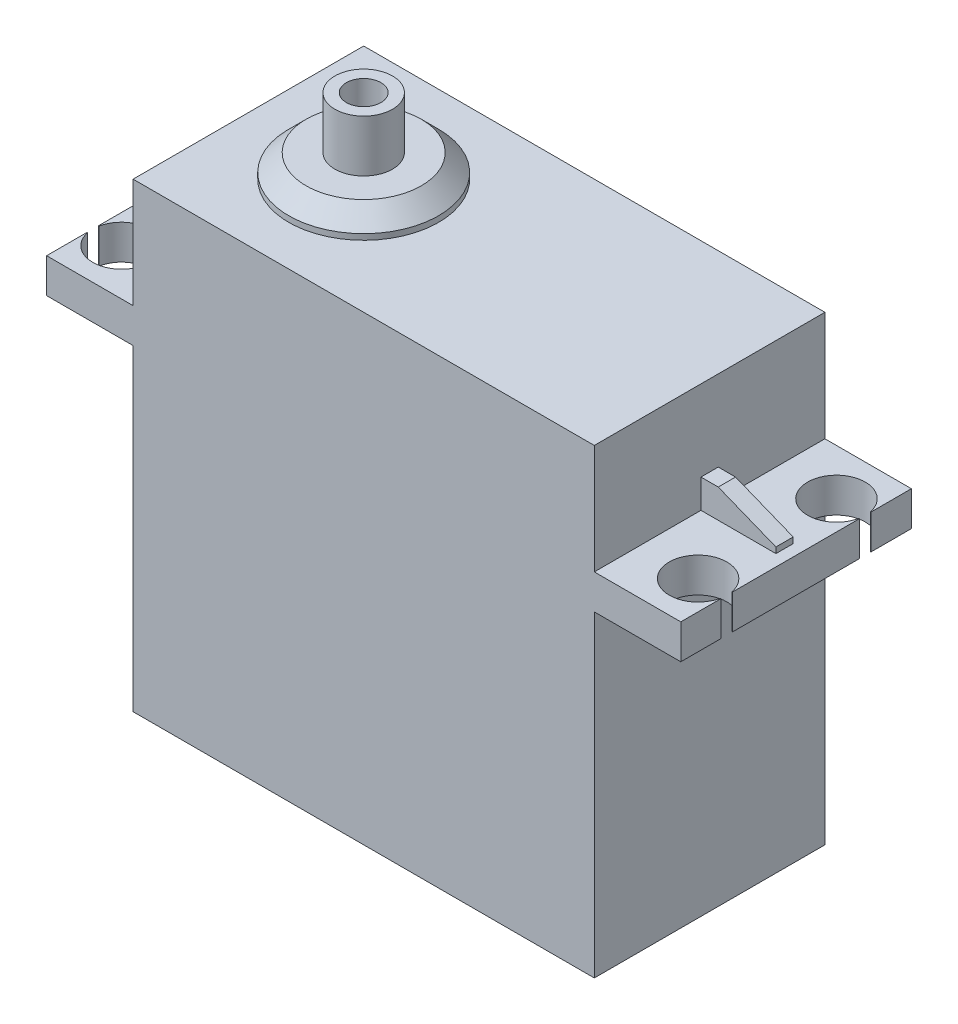
from build123d import *

# Parameters (mm, degrees)
SKETCH1_W           = 40
SKETCH1_H           = 40
BOSS_EXTRUDE1_DEPTH = 10
SKETCH2_R           = 6.5
BOSS_EXTRUDE2_DEPTH = 2
SKETCH3_W           = 7.5
SKETCH3_H           = 20
BOSS_EXTRUDE3_DEPTH = 3
SKETCH4_W           = 6.5
SKETCH4_H           = 1.5
BOSS_EXTRUDE4_DEPTH = 2.5
CUT_EXTRUDE1_DEPTH  = 2.5
CUT_EXTRUDE6_DEPTH  = 12.5
CHAMFER1_SIZE       = 1.5
SKETCH8_W           = 7
SKETCH8_H           = 4
SKETCH8_W_2         = 5
SKETCH8_H_2         = 2
BOSS_EXTRUDE6_DEPTH = 6
SKETCH7_R           = 2.5
SKETCH7_R_2         = 1.5
BOSS_EXTRUDE7_DEPTH = 4.5


with BuildPart() as part:
    # Sketch1 → Boss-Extrude1 (new, symmetric)
    with BuildSketch(Plane.XY):
        Rectangle(SKETCH1_W, SKETCH1_H)
    extrude(amount=BOSS_EXTRUDE1_DEPTH, both=True)

    # Sketch2 → Boss-Extrude2 (add)
    with BuildSketch(Plane(origin=(0, 20, 0), x_dir=(1, 0, 0), z_dir=(0, 1, 0))):
        with Locations(Location((-10, 0, 0), (0, 0, 90))):
            Circle(SKETCH2_R)
    extrude(amount=BOSS_EXTRUDE2_DEPTH)

    # Sketch3 → Boss-Extrude3 (add)
    with BuildSketch(Plane(origin=(0, 7.5, 0), x_dir=(-1, 0, 0), z_dir=(0, -1, 0))):
        with Locations((23.75, 0)):
            Rectangle(SKETCH3_W, SKETCH3_H)
        with Locations((-23.75, 0)):
            Rectangle(SKETCH3_W, SKETCH3_H)
    extrude(amount=-BOSS_EXTRUDE3_DEPTH)

    # Sketch4 → Boss-Extrude4 (add)
    with BuildSketch(Plane(origin=(0, 10.5, 0), x_dir=(1, 0, 0), z_dir=(0, 1, 0))):
        with Locations((23.25, 0)):
            Rectangle(SKETCH4_W, SKETCH4_H)
    boss_extrude4 = extrude(amount=BOSS_EXTRUDE4_DEPTH)

    # Sketch5 → Cut-Extrude1 (cut)
    with BuildSketch(Plane.XY.offset(0.75)):
        Polygon((26.5, 11), (21.5, 13), (26.5, 13), align=None)
    cut_extrude1 = extrude(amount=-CUT_EXTRUDE1_DEPTH, mode=Mode.SUBTRACT)

    # Sketch6 → Cut-Extrude6 (cut)
    with BuildSketch(Plane(origin=(0, 10.5, 0), x_dir=(1, 0, 0), z_dir=(0, 1, 0))):
        with BuildLine():
            Line((-27.449489743, 6.5), (-27.5, 6.5))
            Line((-27.5, 6.5), (-27.5, 5.5))
            Line((-27.5, 5.5), (-27.449489743, 5.5))
            ThreePointArc((-27.449489743, 5.5), (-22.5, 6), (-27.449489743, 6.5))
        make_face()
        with BuildLine():
            Line((-27.449489743, -5.5), (-27.5, -5.5))
            Line((-27.5, -5.5), (-27.5, -6.5))
            Line((-27.5, -6.5), (-27.449489743, -6.5))
            ThreePointArc((-27.449489743, -6.5), (-22.5, -6), (-27.449489743, -5.5))
        make_face()
    cut_extrude6 = extrude(amount=-CUT_EXTRUDE6_DEPTH, mode=Mode.SUBTRACT)

    # Mirror1: Boss-Extrude4, Cut-Extrude1, Cut-Extrude6 across plane
    add(boss_extrude4.mirror(Plane(origin=(0, 0, 0), x_dir=(0, 0, 1), z_dir=(1, 0, 0))))
    add(cut_extrude1.mirror(Plane(origin=(0, 0, 0), x_dir=(0, 0, 1), z_dir=(1, 0, 0))), mode=Mode.SUBTRACT)
    add(cut_extrude6.mirror(Plane(origin=(0, 0, 0), x_dir=(0, 0, 1), z_dir=(1, 0, 0))), mode=Mode.SUBTRACT)

    # Chamfer1
    chamfer1_edges = [part.edges().sort_by_distance(p)[0] for p in [
        (-10, 22, 6.5),
    ]]
    chamfer(chamfer1_edges, length=CHAMFER1_SIZE)

    # Sketch8 → Boss-Extrude6 (add)
    with BuildSketch(Plane.ZY.offset(20)):
        with Locations((0, -11)):
            Rectangle(SKETCH8_W, SKETCH8_H)
        with Locations((0, -11)):
            Rectangle(SKETCH8_W_2, SKETCH8_H_2, mode=Mode.SUBTRACT)
    extrude(amount=BOSS_EXTRUDE6_DEPTH)

    # Sketch7 → Boss-Extrude7 (add)
    with BuildSketch(Plane(origin=(0, 22, 0), x_dir=(1, 0, 0), z_dir=(0, 1, 0))):
        with Locations(Location((-10, 0, 0), (0, 0, 270))):
            Circle(SKETCH7_R)
        with Locations(Location((-10, 0, 0), (0, 0, 270))):
            Circle(SKETCH7_R_2, mode=Mode.SUBTRACT)
    extrude(amount=BOSS_EXTRUDE7_DEPTH)


solid = part.part
